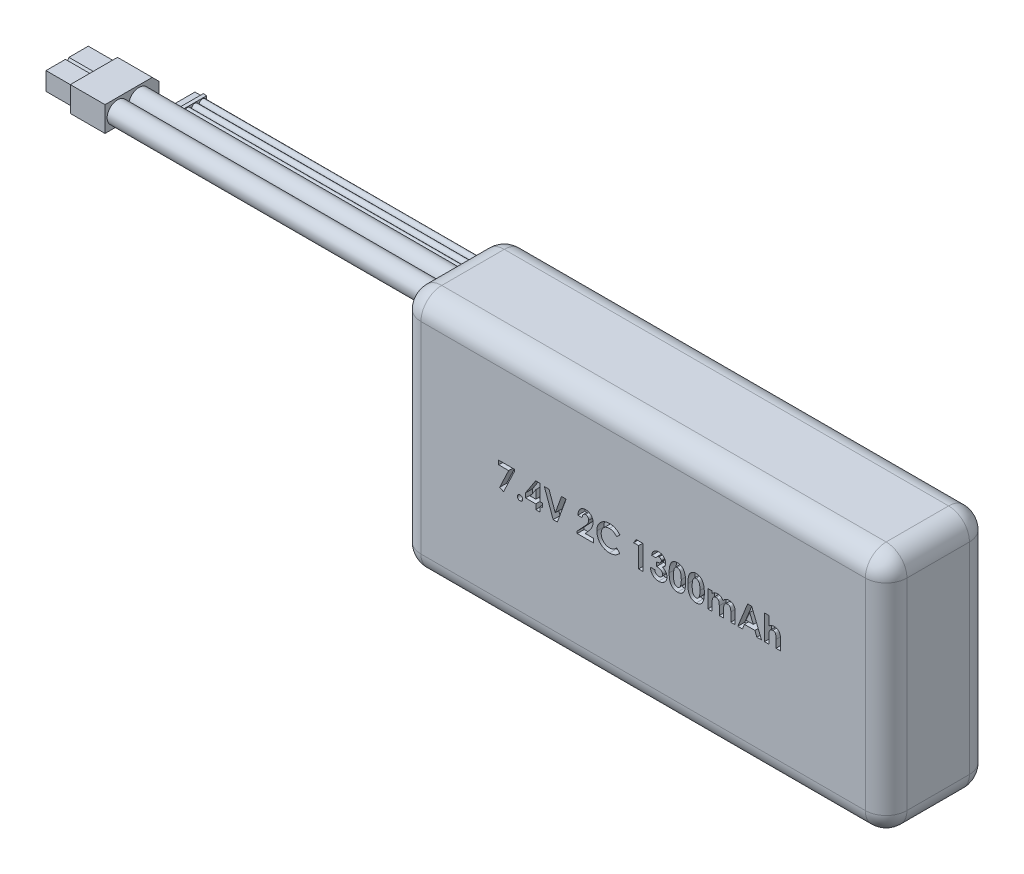
from build123d import *

# Parameters (mm, degrees)
SKETCH_1_W           = 70
SKETCH_1_H           = 35
EXTRUDE_1_DEPTH      = 15
FILLET_2_R           = 3
CUT_EXTRUDE_2_DEPTH  = 1
EXTRUDE_2_DEPTH      = 50
EXTRUDE_2_DEPTH_BACK = 5
SKETCH_3_R           = 1.5
SKETCH_5_W           = 7.8
SKETCH_5_H           = 3.6
EXTRUDE_3_DEPTH      = 5
CHAMFER_1_SIZE       = 1
EXTRUDE_4_DEPTH      = 4
CUT_EXTRUDE_3_DEPTH  = 4
EXTRUDE_5_DEPTH      = 40
EXTRUDE_5_DEPTH_BACK = 4
SKETCH_7_R           = 0.5
SKETCH_8_W           = 3.4
SKETCH_8_H           = 1.2
EXTRUDE_6_DEPTH      = 0.5
EXTRUDE_7_DEPTH      = 1


with BuildPart() as part:
    # ｽｹｯﾁ1 → ﾎﾞｽ - 押し出し1 (new body)
    with BuildSketch(Plane.XY):
        Rectangle(SKETCH_1_W, SKETCH_1_H)
    extrude(amount=EXTRUDE_1_DEPTH)

    # ﾌｨﾚｯﾄ2
    fillet_2_edges = [part.edges().sort_by_distance(p)[0] for p in [
        (35, 0, 15),
        (0, 17.5, 15),
        (-35, 0, 15),
        (0, 17.5, 0),
        (35, 0, 0),
        (0, -17.5, 0),
        (-35, 0, 0),
        (0, -17.5, 15),
        (-35, 17.5, 7.5),
        (35, 17.5, 7.5),
        (35, -17.5, 7.5),
        (-35, -17.5, 7.5),
    ]]
    fillet(fillet_2_edges, radius=FILLET_2_R)

    # ｽｹｯﾁ2 → ｶｯﾄ - 押し出し2 (cut)
    # profile 1 of 13: a face of its own
    with BuildSketch(Plane.XY.offset(15)):
        Polygon((-20.796502723, 2.806037284), (-18.552912979, 2.806037284), (-18.552912979, 2.48001565), (-20.096783171, -0.783706305), (-20.653473877, -0.503257587), (-19.363409774, 2.222703951), (-20.796502723, 2.222703951), align=None)
    # profile 2 of 13: a face of its own
    with BuildSketch(Plane.XY.offset(15)):
        with BuildLine():
            add(Edge.make_bspline(
                [(-17.722784774, 0.023986002), (-17.697424878, 0.02259558), (-17.647495622, 0.019858079), (-17.575354655, -0.000571605), (-17.510247017, -0.037276444), (-17.45203209, -0.085151545), (-17.402807013, -0.142751683), (-17.367228241, -0.208437598), (-17.345072447, -0.280300596), (-17.342626431, -0.330386935), (-17.341374518, -0.35602201)],
                knots=[0, 0, 0, 0, 1.016957001, 2.002212695, 2.9757545, 3.99499976, 5.013036768, 5.994806404, 6.97370641, 8, 8, 8, 8], degree=3))
            add(Edge.make_bspline(
                [(-17.341374518, -0.35602201), (-17.34261823, -0.381661203), (-17.345048222, -0.431755586), (-17.367381557, -0.503758614), (-17.402753847, -0.569984407), (-17.452036039, -0.628201769), (-17.510005929, -0.676979121), (-17.575504349, -0.713345487), (-17.647358195, -0.734934096), (-17.697400689, -0.737521864), (-17.722784774, -0.73883451)],
                knots=[0, 0, 0, 0, 1.023218912, 1.999186227, 2.986238111, 4.008388923, 5.030539734, 6.0011649, 6.986089706, 8, 8, 8, 8], degree=3))
            add(Edge.make_bspline(
                [(-17.722784774, -0.73883451), (-17.748174874, -0.737532538), (-17.798229225, -0.734965813), (-17.870194763, -0.713163516), (-17.936176743, -0.677221916), (-17.994161198, -0.628142602), (-18.043663561, -0.57019056), (-18.078030185, -0.50354966), (-18.100571548, -0.431782732), (-18.10296832, -0.381670393), (-18.10419503, -0.35602201)],
                knots=[0, 0, 0, 0, 1.013427518, 1.99788335, 2.976245624, 3.997909735, 5.019573847, 6.001765691, 6.977268297, 8, 8, 8, 8], degree=3))
            add(Edge.make_bspline(
                [(-18.10419503, -0.35602201), (-18.102960227, -0.330377585), (-18.100547643, -0.280272977), (-18.078183064, -0.208648959), (-18.043608483, -0.14254441), (-17.994165326, -0.085210835), (-17.935934413, -0.037035544), (-17.870345297, -0.000751083), (-17.798091867, 0.01989003), (-17.748150714, 0.022606342), (-17.722784774, 0.023986002)],
                knots=[0, 0, 0, 0, 1.025808215, 2.00424526, 2.981110158, 3.998665696, 5.017428914, 5.998734231, 6.983523959, 8, 8, 8, 8], degree=3))
        make_face()
    # profile 3 of 13: a face of its own
    with BuildSketch(Plane.XY.offset(15)):
        Polygon((-15.483401761, 2.895780874), (-14.828554005, 2.895780874), (-14.828554005, 0.607319336), (-14.514451441, 0.607319336), (-14.514451441, 0.023986002), (-14.828554005, 0.023986002), (-14.828554005, -0.693962716), (-15.456759133, -0.693962716), (-15.456759133, 0.023986002), (-16.937528364, 0.023986002), (-16.937528364, 0.65990347), align=None)
        Polygon((-15.456759133, 0.607319336), (-15.456759133, 1.798525265), (-16.231498716, 0.607319336), align=None, mode=Mode.SUBTRACT)
    # profile 4 of 13: a face of its own
    with BuildSketch(Plane.XY.offset(15)):
        Polygon((-14.222784774, 2.806037284), (-13.551811216, 2.806037284), (-12.652271954, 0.3198594), (-11.750629325, 2.806037284), (-11.081759133, 2.806037284), (-12.350789582, -0.693962716), (-12.955857691, -0.693962716), align=None)
    # profile 5 of 13: a face of its own
    with BuildSketch(Plane.XY.offset(15)):
        with BuildLine():
            Line((-8.770861697, 1.639370618), (-9.399066825, 1.639370618))
            add(Edge.make_bspline(
                [(-9.399066825, 1.639370618), (-9.396353704, 1.686891012), (-9.391052427, 1.77974301), (-9.369965288, 1.91461351), (-9.341709246, 2.042051301), (-9.303997806, 2.161610593), (-9.256610915, 2.273247941), (-9.200767958, 2.377343922), (-9.135042276, 2.473350471), (-9.060832727, 2.560804588), (-8.979399185, 2.639260483), (-8.89243229, 2.708824409), (-8.798601767, 2.76622681), (-8.699621976, 2.813463671), (-8.59550977, 2.851203729), (-8.485280086, 2.876436011), (-8.369887351, 2.89352356), (-8.29089168, 2.895018789), (-8.250629325, 2.895780874)],
                knots=[0, 0, 0, 0, 1.199038563, 2.342849363, 3.436047546, 4.486744587, 5.497670872, 6.488682221, 7.459191391, 8.424610317, 9.374430501, 10.305433194, 11.225809216, 12.140057399, 13.06607119, 14.010487599, 14.985989317, 16, 16, 16, 16], degree=3))
            add(Edge.make_bspline(
                [(-8.250629325, 2.895780874), (-8.201207856, 2.894238794), (-8.104725565, 2.891228292), (-7.964529145, 2.865547713), (-7.833601016, 2.822592975), (-7.712036353, 2.762573878), (-7.600870055, 2.686325907), (-7.500120559, 2.595412681), (-7.412834688, 2.487926791), (-7.338459025, 2.368340552), (-7.276661738, 2.241715555), (-7.233356774, 2.110780056), (-7.204892887, 1.979008555), (-7.201857037, 1.890280295), (-7.200348877, 1.846201547)],
                knots=[0, 0, 0, 0, 1.075374347, 2.099382735, 3.09057751, 4.06680945, 5.040638231, 6.016817125, 7.011024321, 8.044445721, 9.0776792, 10.070479129, 11.0414456, 12, 12, 12, 12], degree=3))
            add(Edge.make_bspline(
                [(-7.200348877, 1.846201547), (-7.200936075, 1.819539605), (-7.202117959, 1.765875702), (-7.21033576, 1.684669045), (-7.222664085, 1.601950571), (-7.241252195, 1.517791203), (-7.264433091, 1.43216735), (-7.292554869, 1.344822768), (-7.326269841, 1.256252671), (-7.365015373, 1.165460216), (-7.41123889, 1.072150636), (-7.465059751, 0.974925183), (-7.527906482, 0.873870106), (-7.599019976, 0.768414813), (-7.678745612, 0.658725624), (-7.767472586, 0.545132958), (-7.864178971, 0.427236549), (-7.932814213, 0.348429416), (-7.968077242, 0.307940329)],
                knots=[0, 0, 0, 0, 0.728284026, 1.46585585, 2.227944881, 3.01186502, 3.81876927, 4.650621989, 5.517437689, 6.406905708, 7.346299482, 8.360816762, 9.441613733, 10.596154504, 11.834900912, 13.145207542, 14.533280747, 16, 16, 16, 16], degree=3))
            Line((-7.968077242, 0.307940329), (-8.333361697, -0.110629382))
            Line((-8.333361697, -0.110629382), (-7.155477082, -0.110629382))
            Line((-7.155477082, -0.110629382), (-7.155477082, -0.693962716))
            Line((-7.155477082, -0.693962716), (-9.488810415, -0.693962716))
            Line((-9.488810415, -0.693962716), (-9.488810415, -0.375653421))
            Line((-9.488810415, -0.375653421), (-8.452552402, 0.727211163))
            add(Edge.make_bspline(
                [(-8.452552402, 0.727211163), (-8.42255007, 0.759382065), (-8.364444449, 0.821687562), (-8.281766139, 0.913189814), (-8.206949572, 1.000023267), (-8.14154613, 1.083112521), (-8.082123525, 1.159762501), (-8.031331406, 1.232283531), (-7.988705065, 1.300019996), (-7.942428126, 1.381698343), (-7.898480246, 1.479114306), (-7.858155406, 1.59134149), (-7.833574626, 1.698604831), (-7.830181701, 1.76849993), (-7.828554005, 1.802030874)],
                knots=[0, 0, 0, 0, 1.246127091, 2.413378631, 3.493388633, 4.492180848, 5.408488754, 6.240484944, 6.999099869, 7.674939598, 8.898438119, 10.020720584, 11.050475521, 12, 12, 12, 12], degree=3))
            add(Edge.make_bspline(
                [(-7.828554005, 1.802030874), (-7.829770994, 1.834469476), (-7.832129105, 1.897324467), (-7.858042839, 1.986735357), (-7.898189293, 2.067687791), (-7.954761317, 2.137762818), (-8.023287756, 2.195348115), (-8.102476494, 2.238178441), (-8.191681909, 2.262891343), (-8.254216604, 2.265984515), (-8.286386537, 2.267575746)],
                knots=[0, 0, 0, 0, 1.062038974, 2.057870785, 3.028805853, 4.01125022, 4.991535629, 5.949134679, 6.94496649, 8, 8, 8, 8], degree=3))
            add(Edge.make_bspline(
                [(-8.286386537, 2.267575746), (-8.303005934, 2.266987926), (-8.335723886, 2.265830708), (-8.383816718, 2.258127423), (-8.429580502, 2.244551188), (-8.473524616, 2.226360943), (-8.515180077, 2.202249642), (-8.554441815, 2.172528623), (-8.591723502, 2.137953164), (-8.626854151, 2.098631377), (-8.658827628, 2.054748251), (-8.687226353, 2.00670457), (-8.710707371, 1.954530154), (-8.731380913, 1.898913787), (-8.747325337, 1.839258102), (-8.758934856, 1.775920132), (-8.767760798, 1.709002921), (-8.769809261, 1.66300363), (-8.770861697, 1.639370618)],
                knots=[0, 0, 0, 0, 0.903469896, 1.778625579, 2.63899355, 3.493148037, 4.358286772, 5.247621495, 6.164656832, 7.118446693, 8.109501108, 9.111810964, 10.146451449, 11.215617525, 12.33435995, 13.498009769, 14.714554818, 16, 16, 16, 16], degree=3))
        make_face()
    # profile 6 of 13: a face of its own
    with BuildSketch(Plane.XY.offset(15)):
        with BuildLine():
            Line((-3.341374518, 2.19886581), (-3.802011537, 1.758561323))
            add(Edge.make_bspline(
                [(-3.802011537, 1.758561323), (-3.841086522, 1.798964923), (-3.917412208, 1.877885811), (-4.040401613, 1.982370112), (-4.168306116, 2.069443639), (-4.298637591, 2.14277641), (-4.433740322, 2.198257877), (-4.572052154, 2.238688157), (-4.714456249, 2.26333697), (-4.810829864, 2.266157231), (-4.859303204, 2.267575746)],
                knots=[0, 0, 0, 0, 1.115251505, 2.178435587, 3.19620269, 4.182487026, 5.141301733, 6.088180966, 7.038406374, 8, 8, 8, 8], degree=3))
            add(Edge.make_bspline(
                [(-4.859303204, 2.267575746), (-4.899784333, 2.266455069), (-4.979669381, 2.264243537), (-5.096961566, 2.248030827), (-5.209157603, 2.220460408), (-5.316641556, 2.182463263), (-5.41909715, 2.133296975), (-5.516739195, 2.072999596), (-5.609326958, 2.002115697), (-5.69563741, 1.921012036), (-5.774591179, 1.832400192), (-5.84435186, 1.737851565), (-5.902787621, 1.637582762), (-5.950744899, 1.532609231), (-5.988101766, 1.422445103), (-6.014779261, 1.307164544), (-6.030208812, 1.186630264), (-6.032511776, 1.104691959), (-6.03368221, 1.063048502)],
                knots=[0, 0, 0, 0, 1.035432265, 2.043311493, 3.022114605, 3.98653278, 4.95457646, 5.923598177, 6.917315552, 7.932509744, 8.948865224, 9.949768934, 10.933144597, 11.912367597, 12.897413939, 13.903909035, 14.934704909, 16, 16, 16, 16], degree=3))
            add(Edge.make_bspline(
                [(-6.03368221, 1.063048502), (-6.033344904, 1.033820211), (-6.032680068, 0.976210647), (-6.025402256, 0.890990113), (-6.013683264, 0.808306048), (-5.996722979, 0.728283696), (-5.975513975, 0.65085371), (-5.950630985, 0.575348104), (-5.919415639, 0.502810196), (-5.884766135, 0.432397506), (-5.84446916, 0.366031331), (-5.801021588, 0.302745676), (-5.75390979, 0.24285076), (-5.702828619, 0.186591435), (-5.647059172, 0.134846909), (-5.588042883, 0.086061162), (-5.524784229, 0.041455467), (-5.458597251, -8.9606e-05), (-5.388910179, -0.036180164), (-5.317613785, -0.068871237), (-5.24362707, -0.095421249), (-5.167850868, -0.11682298), (-5.090555976, -0.135021957), (-5.010986379, -0.146227626), (-4.929831845, -0.154713548), (-4.874985002, -0.155237504), (-4.847384133, -0.155501177)],
                knots=[0, 0, 0, 0, 1.103660481, 2.175337485, 3.227646561, 4.255952547, 5.262355991, 6.258840057, 7.255597736, 8.242457506, 9.22035537, 10.185017736, 11.140346927, 12.096287581, 13.051739095, 14.01125915, 14.986044842, 15.97314143, 16.960198552, 17.947847494, 18.933482797, 19.925264591, 20.920966487, 21.929612487, 22.958107872, 24, 24, 24, 24], degree=3))
            add(Edge.make_bspline(
                [(-4.847384133, -0.155501177), (-4.800568316, -0.154147015), (-4.70858741, -0.151486439), (-4.573592204, -0.130681112), (-4.444955222, -0.096457527), (-4.342174889, -0.056041461), (-4.261649212, -0.016130071), (-4.200346205, 0.020785999), (-4.136954118, 0.062080677), (-4.072525839, 0.109312468), (-4.006336678, 0.161914572), (-3.939555026, 0.221039073), (-3.870471261, 0.284739086), (-3.825215172, 0.330203037), (-3.802011537, 0.353513246)],
                knots=[0, 0, 0, 0, 1.404581149, 2.759636711, 4.088442092, 5.392261763, 6.066678138, 6.783632037, 7.538459478, 8.336747902, 9.180226004, 10.074962426, 11.012997595, 12, 12, 12, 12], degree=3))
            Line((-3.802011537, 0.353513246), (-3.355396954, -0.115537235))
            add(Edge.make_bspline(
                [(-3.355396954, -0.115537235), (-3.386791555, -0.145847737), (-3.448067103, -0.205007354), (-3.540499565, -0.289008491), (-3.632815698, -0.36449285), (-3.722785335, -0.434200184), (-3.811882274, -0.496099747), (-3.900097065, -0.550253361), (-3.986431079, -0.598030647), (-4.072677068, -0.638625867), (-4.159371701, -0.673095424), (-4.24857029, -0.702771451), (-4.340545524, -0.727876302), (-4.435859146, -0.748132619), (-4.533622127, -0.764375451), (-4.634749401, -0.775339269), (-4.738599769, -0.782709879), (-4.809043083, -0.783372189), (-4.844579646, -0.783706305)],
                knots=[0, 0, 0, 0, 1.244526981, 2.429050516, 3.560637417, 4.644440555, 5.67424972, 6.652764056, 7.595344123, 8.486817594, 9.369275933, 10.254498637, 11.166417451, 12.086725134, 13.032340136, 13.991389299, 14.986715468, 16, 16, 16, 16], degree=3))
            add(Edge.make_bspline(
                [(-4.844579646, -0.783706305), (-4.90985591, -0.782042283), (-5.037583414, -0.778786254), (-5.22476474, -0.754661285), (-5.402581976, -0.7142162), (-5.571467717, -0.657015694), (-5.731368261, -0.583944728), (-5.882242701, -0.494363155), (-6.023847862, -0.388508978), (-6.155039851, -0.267622913), (-6.273709249, -0.134114401), (-6.378599254, 0.009237113), (-6.46536427, 0.16313615), (-6.537407132, 0.325309131), (-6.593743703, 0.496496112), (-6.633395099, 0.676882267), (-6.657847825, 0.866293421), (-6.660522988, 0.995665605), (-6.661887338, 1.061646259)],
                knots=[0, 0, 0, 0, 1.078019885, 2.10938526, 3.111377082, 4.085535484, 5.04941344, 6.010039228, 6.978205633, 7.964457913, 8.951525778, 9.924444315, 10.892603023, 11.863865945, 12.85144698, 13.863884204, 14.910567087, 16, 16, 16, 16], degree=3))
            add(Edge.make_bspline(
                [(-6.661887338, 1.061646259), (-6.66131083, 1.104678278), (-6.660168331, 1.189957223), (-6.648160564, 1.315580017), (-6.631421038, 1.438039771), (-6.604865302, 1.556064947), (-6.572854982, 1.671245561), (-6.533045943, 1.782329735), (-6.485501766, 1.889636736), (-6.431754911, 1.993346202), (-6.370951632, 2.092778724), (-6.303027695, 2.187080022), (-6.229731726, 2.276978083), (-6.149302543, 2.361280243), (-6.062908887, 2.440726692), (-5.970160701, 2.514886893), (-5.871615818, 2.584824387), (-5.767007515, 2.648735658), (-5.658368052, 2.706546799), (-5.547067658, 2.757538694), (-5.433379786, 2.800156176), (-5.317785118, 2.835505805), (-5.199795268, 2.861891804), (-5.080252418, 2.881865154), (-4.958139402, 2.893030384), (-4.87615109, 2.894858203), (-4.834763941, 2.895780874)],
                knots=[0, 0, 0, 0, 1.071919942, 2.124283339, 3.142214191, 4.149696895, 5.136002878, 6.119640489, 7.086990633, 8.058538607, 9.028339693, 9.988281803, 10.952401235, 11.916291999, 12.888973767, 13.874849856, 14.873389453, 15.898127285, 16.927174885, 17.938320013, 18.946391617, 19.950418109, 20.947802303, 21.956882652, 22.968648068, 24, 24, 24, 24], degree=3))
            add(Edge.make_bspline(
                [(-4.834763941, 2.895780874), (-4.799456458, 2.895251976), (-4.729208594, 2.894199679), (-4.624597735, 2.885427639), (-4.520823504, 2.871651238), (-4.418257446, 2.850865583), (-4.316165903, 2.826190383), (-4.215890472, 2.793881614), (-4.115849255, 2.757867401), (-4.017611248, 2.714819764), (-3.921039326, 2.667829379), (-3.828395839, 2.614517081), (-3.738125311, 2.558163649), (-3.652228083, 2.495433841), (-3.569095114, 2.428602982), (-3.489161115, 2.357359269), (-3.413127552, 2.280514861), (-3.365413109, 2.22621975), (-3.341374518, 2.19886581)],
                knots=[0, 0, 0, 0, 0.996412454, 1.982464992, 2.961075852, 3.949442424, 4.934965278, 5.923860011, 6.921385422, 7.934793307, 8.949617135, 9.951082467, 10.950285876, 11.951772932, 12.951063433, 13.960125323, 14.972308753, 16, 16, 16, 16], degree=3))
        make_face()
    # profile 7 of 13: a face of its own
    with BuildSketch(Plane.XY.offset(15)):
        Polygon((-0.991915383, 2.806037284), (-0.020861697, 2.806037284), (-0.020861697, -0.693962716), (-0.649066825, -0.693962716), (-0.649066825, 2.222703951), (-1.367015543, 2.222703951), align=None)
    # profile 8 of 13: a face of its own
    with BuildSketch(Plane.XY.offset(15)):
        with BuildLine():
            Line((1.863753688, 1.953473182), (1.235548559, 1.953473182))
            add(Edge.make_bspline(
                [(1.235548559, 1.953473182), (1.239983926, 1.984874915), (1.24867917, 2.046435933), (1.269485725, 2.135560951), (1.294372609, 2.220102131), (1.325442613, 2.299791747), (1.361882673, 2.374771752), (1.403322234, 2.445299443), (1.450209274, 2.5110721), (1.486148687, 2.55069381), (1.504078207, 2.570460361)],
                knots=[0, 0, 0, 0, 1.111473889, 2.178970933, 3.205615836, 4.199322666, 5.174200091, 6.12565194, 7.064921805, 8, 8, 8, 8], degree=3))
            add(Edge.make_bspline(
                [(1.504078207, 2.570460361), (1.529939164, 2.596540893), (1.580908392, 2.647942881), (1.66608395, 2.713783149), (1.755363665, 2.770763424), (1.85053808, 2.815937798), (1.950126211, 2.85250122), (2.054920015, 2.877060954), (2.164491269, 2.893356554), (2.239259865, 2.894961727), (2.277415546, 2.895780874)],
                knots=[0, 0, 0, 0, 1.01925491, 2.00884431, 2.983262333, 3.955970413, 4.92937149, 5.924503185, 6.940838805, 8, 8, 8, 8], degree=3))
            add(Edge.make_bspline(
                [(2.277415546, 2.895780874), (2.311337911, 2.894980034), (2.378022443, 2.893405742), (2.476031927, 2.880768188), (2.569475767, 2.858603323), (2.659341694, 2.829623261), (2.744308071, 2.790191042), (2.826250188, 2.74441863), (2.902878581, 2.688276864), (2.974372546, 2.624842318), (3.040053388, 2.556231646), (3.096933284, 2.482892481), (3.145833952, 2.40678388), (3.186121635, 2.327273525), (3.217097387, 2.244226875), (3.238595479, 2.158123678), (3.252666501, 2.069153929), (3.254068343, 2.008682388), (3.254779329, 1.978012445)],
                knots=[0, 0, 0, 0, 1.091422571, 2.145516843, 3.172569842, 4.178562979, 5.178154469, 6.181868002, 7.194278174, 8.227918432, 9.254613415, 10.245994977, 11.209837596, 12.161663635, 13.10878368, 14.055455738, 15.013766427, 16, 16, 16, 16], degree=3))
            add(Edge.make_bspline(
                [(3.254779329, 1.978012445), (3.253320343, 1.940030273), (3.25044805, 1.865255055), (3.226878805, 1.755815968), (3.189986527, 1.65117267), (3.136692043, 1.552789279), (3.070060364, 1.460933539), (2.988305525, 1.378676464), (2.893756117, 1.304728373), (2.822776617, 1.26498866), (2.78642997, 1.244639047)],
                knots=[0, 0, 0, 0, 0.992805628, 1.954529043, 2.915727527, 3.886831945, 4.871318353, 5.87440735, 6.911542536, 8, 8, 8, 8], degree=3))
            add(Edge.make_bspline(
                [(2.78642997, 1.244639047), (2.811377751, 1.236448165), (2.860399022, 1.22035345), (2.930076865, 1.18865509), (2.996332531, 1.154014037), (3.058025123, 1.113770264), (3.115768247, 1.069551053), (3.169209894, 1.0209784), (3.218669366, 0.968158218), (3.263339258, 0.910800015), (3.302985532, 0.849821123), (3.338558022, 0.78663012), (3.367836165, 0.720268702), (3.392638397, 0.651494761), (3.411521404, 0.579690194), (3.424816729, 0.505133237), (3.432501752, 0.427993959), (3.43367385, 0.375732146), (3.434266508, 0.349306515)],
                knots=[0, 0, 0, 0, 1.059543567, 2.081955587, 3.086750234, 4.076226789, 5.052108497, 6.020845489, 6.989030705, 7.970690546, 8.952259656, 9.923888338, 10.895517021, 11.877585046, 12.873342345, 13.889638361, 14.932918083, 16, 16, 16, 16], degree=3))
            add(Edge.make_bspline(
                [(3.434266508, 0.349306515), (3.43306511, 0.310471568), (3.430696197, 0.233896961), (3.415635757, 0.121110401), (3.387595932, 0.013578436), (3.350707989, -0.08993625), (3.301503476, -0.188097321), (3.243598036, -0.28315744), (3.172420617, -0.371819948), (3.093319137, -0.456428851), (3.005472332, -0.533351478), (2.910232104, -0.600039934), (2.809692704, -0.657270494), (2.703218047, -0.703731894), (2.590845127, -0.739512485), (2.472824411, -0.765376346), (2.348660009, -0.781200284), (2.26390809, -0.782859124), (2.220624681, -0.783706305)],
                knots=[0, 0, 0, 0, 1.005138573, 1.981928558, 2.936866704, 3.876260664, 4.820238198, 5.773547, 6.751179199, 7.756627054, 8.768222608, 9.766606018, 10.760583154, 11.757261445, 12.767156078, 13.807575856, 14.880313354, 16, 16, 16, 16], degree=3))
            add(Edge.make_bspline(
                [(2.220624681, -0.783706305), (2.179679274, -0.782813096), (2.099615949, -0.781066543), (1.982506579, -0.765949242), (1.871205208, -0.741563808), (1.765427793, -0.707190517), (1.665583578, -0.662614233), (1.570767138, -0.609533881), (1.482870513, -0.544887909), (1.400914362, -0.471594559), (1.32671672, -0.389363582), (1.260401501, -0.300099817), (1.203430968, -0.203463831), (1.155571482, -0.099868494), (1.117197199, 0.010867933), (1.086927677, 0.12852026), (1.06578392, 0.253318345), (1.059344544, 0.339182082), (1.05606138, 0.382960361)],
                knots=[0, 0, 0, 0, 1.066544725, 2.085487077, 3.070979577, 4.031932826, 4.977951092, 5.916076795, 6.857635327, 7.814973522, 8.776389752, 9.738577119, 10.707772778, 11.69409279, 12.707140348, 13.757286496, 14.856535458, 16, 16, 16, 16], degree=3))
            Line((1.05606138, 0.382960361), (1.684266508, 0.382960361))
            add(Edge.make_bspline(
                [(1.684266508, 0.382960361), (1.688247378, 0.360948068), (1.696001167, 0.318073353), (1.711124457, 0.256000298), (1.730832214, 0.198703034), (1.753619284, 0.145672304), (1.778232751, 0.096211835), (1.807971704, 0.052148323), (1.84065703, 0.012285263), (1.887822194, -0.035104382), (1.955248044, -0.083795264), (2.046295279, -0.126109956), (2.147576706, -0.150911565), (2.218382525, -0.153937285), (2.254979649, -0.155501177)],
                knots=[0, 0, 0, 0, 0.928156231, 1.807827665, 2.648129825, 3.438902246, 4.202261636, 4.936546065, 5.639352463, 6.338805438, 7.70633318, 9.064371875, 10.482673459, 12, 12, 12, 12], degree=3))
            add(Edge.make_bspline(
                [(2.254979649, -0.155501177), (2.274399377, -0.155168161), (2.312438279, -0.154515857), (2.368311762, -0.147285941), (2.421539122, -0.135378263), (2.472219498, -0.119196171), (2.520675522, -0.098910906), (2.565981396, -0.072754271), (2.609060566, -0.042343449), (2.649444721, -0.008153612), (2.686760513, 0.029101072), (2.717809447, 0.070354305), (2.746185925, 0.112274962), (2.767173373, 0.157605642), (2.785562899, 0.203907069), (2.796818228, 0.252859841), (2.80531681, 0.303437058), (2.805810714, 0.338049886), (2.80606138, 0.355616611)],
                knots=[0, 0, 0, 0, 1.110435564, 2.175094844, 3.216326037, 4.226890168, 5.215276772, 6.21526065, 7.213097102, 8.228249917, 9.239874822, 10.221364777, 11.178138315, 12.128914389, 13.072518965, 14.022636769, 14.996447288, 16, 16, 16, 16], degree=3))
            add(Edge.make_bspline(
                [(2.80606138, 0.355616611), (2.805395908, 0.374828819), (2.804071106, 0.413075921), (2.793247334, 0.468889524), (2.776154311, 0.522577712), (2.752410015, 0.573902729), (2.720702153, 0.6226754), (2.683287229, 0.669874252), (2.637217567, 0.713042671), (2.586672978, 0.755713344), (2.528061111, 0.792909302), (2.464236446, 0.827235705), (2.393521572, 0.854548925), (2.317642703, 0.878944689), (2.235164518, 0.896762977), (2.146599177, 0.90970079), (2.052089548, 0.919330987), (1.986942833, 0.920712597), (1.953497277, 0.9214219)],
                knots=[0, 0, 0, 0, 0.809814727, 1.612155564, 2.388397, 3.182215007, 3.988903953, 4.837162975, 5.715530372, 6.646997145, 7.623086902, 8.637258368, 9.698941581, 10.815059213, 11.996518529, 13.252603015, 14.589518788, 16, 16, 16, 16], degree=3))
            Line((1.953497277, 0.9214219), (1.953497277, 1.504755233))
            add(Edge.make_bspline(
                [(1.953497277, 1.504755233), (1.995138983, 1.508301574), (2.073042367, 1.514936076), (2.181176442, 1.530451088), (2.272211394, 1.551189456), (2.34833525, 1.576209175), (2.411543622, 1.608341013), (2.466762107, 1.643813143), (2.514318878, 1.685008838), (2.554510729, 1.730699647), (2.58666296, 1.779767292), (2.609418435, 1.831449116), (2.624444962, 1.884146019), (2.625868725, 1.920189112), (2.6265742, 1.938048502)],
                knots=[0, 0, 0, 0, 1.70044513, 3.18119609, 4.440695891, 5.496282586, 6.431922213, 7.318171381, 8.16090191, 8.983045123, 9.787564368, 10.536848927, 11.275007137, 12, 12, 12, 12], degree=3))
            add(Edge.make_bspline(
                [(2.6265742, 1.938048502), (2.625357053, 1.960835145), (2.622981439, 2.005309846), (2.604531131, 2.068962514), (2.572503489, 2.125703591), (2.529560043, 2.175413678), (2.477231962, 2.216935269), (2.415894278, 2.247079236), (2.346878022, 2.264790163), (2.298321367, 2.266626189), (2.273208816, 2.267575746)],
                knots=[0, 0, 0, 0, 1.009664648, 1.970651636, 2.907870547, 3.878035693, 4.867062054, 5.849714035, 6.887914197, 8, 8, 8, 8], degree=3))
            add(Edge.make_bspline(
                [(2.273208816, 2.267575746), (2.250447111, 2.266455369), (2.205280919, 2.264232197), (2.139234426, 2.247639033), (2.076512263, 2.219706507), (2.018413227, 2.181189199), (1.965775991, 2.134931544), (1.922576006, 2.080148955), (1.886644308, 2.020123549), (1.871413807, 1.975777067), (1.863753688, 1.953473182)],
                knots=[0, 0, 0, 0, 0.98818071, 1.960853194, 2.938124878, 3.957524365, 4.978590984, 5.968022688, 6.978025184, 8, 8, 8, 8], degree=3))
        make_face()
    # profile 9 of 13: a face of its own
    with BuildSketch(Plane.XY.offset(15)):
        with BuildLine():
            add(Edge.make_bspline(
                [(4.926954809, 2.895780874), (4.957362545, 2.895329463), (5.017152277, 2.894441867), (5.105211299, 2.884828486), (5.190036483, 2.870305348), (5.271959677, 2.850050634), (5.35039119, 2.823244242), (5.425901861, 2.79115745), (5.497592895, 2.75210724), (5.566378583, 2.707998022), (5.632232428, 2.658060135), (5.693571679, 2.601128365), (5.75151652, 2.538512715), (5.80481266, 2.469266548), (5.854640357, 2.394019731), (5.900835887, 2.312760334), (5.943045611, 2.225090645), (5.981742599, 2.130852458), (6.016345567, 2.028633183), (6.045491605, 1.917260321), (6.07048921, 1.796708437), (6.091588952, 1.66667746), (6.107536946, 1.526994548), (6.118286216, 1.377752499), (6.125662873, 1.219239029), (6.126264904, 1.110500091), (6.1265742, 1.054635041)],
                knots=[0, 0, 0, 0, 0.879237366, 1.728815576, 2.559023295, 3.367336655, 4.166867292, 4.954216142, 5.737608147, 6.525189134, 7.316157332, 8.124696809, 8.942788509, 9.781158001, 10.649253743, 11.551476218, 12.482711956, 13.461909668, 14.496590415, 15.601789533, 16.789733467, 18.056700938, 19.410929216, 20.8549011, 22.384193279, 24, 24, 24, 24], degree=3))
            add(Edge.make_bspline(
                [(6.1265742, 1.054635041), (6.126239935, 0.998071056), (6.125590463, 0.888168249), (6.118592865, 0.728204935), (6.106542671, 0.577879298), (6.09101151, 0.437206892), (6.069738069, 0.306262004), (6.044823912, 0.184705573), (6.015217813, 0.072581662), (5.979475033, -0.029857091), (5.941012279, -0.124260781), (5.898687094, -0.211759534), (5.853237199, -0.292590347), (5.805705079, -0.367972661), (5.753484848, -0.435684244), (5.699118211, -0.498027645), (5.640237948, -0.552628122), (5.579323147, -0.60229954), (5.51414225, -0.645225614), (5.445367453, -0.68276805), (5.371772619, -0.713219425), (5.294699257, -0.739704404), (5.212833636, -0.758717761), (5.127476589, -0.773804235), (5.037664454, -0.782141946), (4.976516735, -0.783176294), (4.945183976, -0.783706305)],
                knots=[0, 0, 0, 0, 1.643780988, 3.193836972, 4.651895693, 6.025988579, 7.305620092, 8.505800249, 9.631074763, 10.672816429, 11.65661981, 12.592235626, 13.49536222, 14.350718032, 15.179365177, 15.97804903, 16.751647189, 17.51006938, 18.259804725, 19.016521909, 19.783502495, 20.571750527, 21.382245291, 22.22305063, 23.089471752, 24, 24, 24, 24], degree=3))
            add(Edge.make_bspline(
                [(4.945183976, -0.783706305), (4.913852063, -0.783166071), (4.852473306, -0.782107759), (4.76241831, -0.77386623), (4.676608914, -0.758656645), (4.594095605, -0.739558433), (4.515452661, -0.713278025), (4.440302993, -0.681915567), (4.369224436, -0.644607377), (4.302020185, -0.60158129), (4.238919694, -0.552242211), (4.178942383, -0.497117878), (4.122220924, -0.436348015), (4.069618191, -0.36925195), (4.020272705, -0.296725277), (3.974699059, -0.217939775), (3.932924644, -0.133010154), (3.893642747, -0.041818032), (3.859511751, 0.057599855), (3.829136749, 0.166131294), (3.804254346, 0.284680984), (3.784242253, 0.413210842), (3.768264609, 0.551448569), (3.756379079, 0.699460891), (3.749342612, 0.857316746), (3.748699952, 0.965818939), (3.748369072, 1.021682316)],
                knots=[0, 0, 0, 0, 0.917216111, 1.796812873, 2.643793957, 3.46689424, 4.273913431, 5.068098542, 5.848489301, 6.620921603, 7.401012384, 8.190319798, 9.003608147, 9.831726257, 10.68377682, 11.569763213, 12.493818149, 13.453288342, 14.474581811, 15.568529029, 16.750744269, 18.018426408, 19.375425659, 20.823733699, 22.36466933, 24, 24, 24, 24], degree=3))
            add(Edge.make_bspline(
                [(3.748369072, 1.021682316), (3.74896843, 1.099300082), (3.750124899, 1.24906456), (3.764780519, 1.465430686), (3.786291253, 1.665423691), (3.817885425, 1.848709033), (3.856951182, 2.015965549), (3.906976918, 2.166091441), (3.963927579, 2.301164036), (4.012456859, 2.381181855), (4.035829008, 2.419719175)],
                knots=[0, 0, 0, 0, 1.288568992, 2.486310467, 3.599230591, 4.627010532, 5.572937695, 6.447898582, 7.252493626, 8, 8, 8, 8], degree=3))
            add(Edge.make_bspline(
                [(4.035829008, 2.419719175), (4.06300503, 2.457578227), (4.116139508, 2.531600133), (4.209046628, 2.628777058), (4.308863232, 2.711887524), (4.417639496, 2.779050665), (4.533655078, 2.832015523), (4.657906032, 2.869424006), (4.789933518, 2.891219931), (4.880598996, 2.894237857), (4.926954809, 2.895780874)],
                knots=[0, 0, 0, 0, 1.058512271, 2.069600068, 3.047294572, 4.004278952, 4.967380941, 5.939006123, 6.946246673, 8, 8, 8, 8], degree=3))
        make_face()
        with BuildLine():
            add(Edge.make_bspline(
                [(4.942379489, 2.267575746), (4.914890644, 2.266272829), (4.860997915, 2.263718421), (4.782796999, 2.2420351), (4.709058417, 2.20854404), (4.652967447, 2.168242787), (4.610983914, 2.129609203), (4.581649719, 2.094647065), (4.553361511, 2.05563184), (4.528375941, 2.010802969), (4.50478304, 1.961771208), (4.481725665, 1.908313982), (4.462824672, 1.849118266), (4.444254948, 1.78519217), (4.427986136, 1.714768307), (4.414356439, 1.63727104), (4.402179503, 1.552196398), (4.393685944, 1.459488657), (4.385767399, 1.35924481), (4.38009101, 1.251241555), (4.377717855, 1.135508028), (4.376963501, 1.055804065), (4.3765742, 1.014671099)],
                knots=[0, 0, 0, 0, 1.076674018, 2.110852608, 3.161083442, 4.239746716, 4.804137807, 5.395870207, 6.026861976, 6.692161227, 7.405688833, 8.16177676, 8.973626916, 9.841385931, 10.773283133, 11.807421078, 12.927755683, 14.143907515, 15.458935494, 16.872852025, 18.386167141, 20, 20, 20, 20], degree=3))
            add(Edge.make_bspline(
                [(4.3765742, 1.014671099), (4.377214942, 0.961381352), (4.378443612, 0.859194311), (4.384878811, 0.712245788), (4.397777634, 0.578510799), (4.413821165, 0.457082974), (4.436354959, 0.348749803), (4.462281548, 0.252486355), (4.494298581, 0.169519754), (4.531300431, 0.098650118), (4.572281647, 0.038361466), (4.616768559, -0.01288416), (4.663246549, -0.057260455), (4.713166344, -0.093306772), (4.766408852, -0.120931008), (4.822529595, -0.140800779), (4.881564237, -0.152963894), (4.921990552, -0.154650527), (4.942379489, -0.155501177)],
                knots=[0, 0, 0, 0, 1.771748488, 3.397459088, 4.888034009, 6.237357457, 7.467047327, 8.564189669, 9.548206622, 10.417051504, 11.216568818, 11.965764335, 12.669334354, 13.348544111, 14.005342236, 14.656555988, 15.322436492, 16, 16, 16, 16], degree=3))
            add(Edge.make_bspline(
                [(4.942379489, -0.155501177), (4.962068742, -0.154919099), (5.000617852, -0.153779462), (5.056831088, -0.142081247), (5.109990317, -0.123062489), (5.159935037, -0.09615912), (5.206843892, -0.061947371), (5.250487621, -0.0202769), (5.290537072, 0.02926765), (5.313870063, 0.066037034), (5.325893111, 0.084983599)],
                knots=[0, 0, 0, 0, 0.992283464, 1.942767638, 2.88273346, 3.832339453, 4.79467288, 5.803907806, 6.868395428, 8, 8, 8, 8], degree=3))
            add(Edge.make_bspline(
                [(5.325893111, 0.084983599), (5.340048224, 0.110873474), (5.369730348, 0.165162442), (5.404078553, 0.256773052), (5.432990958, 0.360094679), (5.457875443, 0.475448869), (5.474894912, 0.603290595), (5.489552058, 0.742809199), (5.496621564, 0.894707242), (5.497771457, 0.999942755), (5.498369072, 1.054635041)],
                knots=[0, 0, 0, 0, 0.710965849, 1.490837728, 2.352621235, 3.297892224, 4.334225155, 5.461620853, 6.680770821, 8, 8, 8, 8], degree=3))
            add(Edge.make_bspline(
                [(5.498369072, 1.054635041), (5.498138226, 1.109802082), (5.497693888, 1.21598922), (5.489541561, 1.368433347), (5.478188823, 1.507665757), (5.461583044, 1.6333756), (5.440216692, 1.745868046), (5.413882582, 1.845135739), (5.382836625, 1.931374317), (5.34601982, 2.004497789), (5.305242921, 2.06664271), (5.261956998, 2.119958231), (5.215979021, 2.165477679), (5.167385879, 2.203372349), (5.115052867, 2.232326719), (5.059979615, 2.2527709), (5.002053217, 2.265138944), (4.962539213, 2.266752515), (4.942379489, 2.267575746)],
                knots=[0, 0, 0, 0, 1.793836731, 3.452829483, 4.963243077, 6.335886805, 7.574563692, 8.684454726, 9.672768357, 10.54971625, 11.340229787, 12.085688095, 12.778991901, 13.440269426, 14.083255152, 14.715733572, 15.344777694, 16, 16, 16, 16], degree=3))
        make_face(mode=Mode.SUBTRACT)
    # profile 10 of 13: a face of its own
    with BuildSketch(Plane.XY.offset(15)):
        with BuildLine():
            add(Edge.make_bspline(
                [(7.619262502, 2.895780874), (7.649670237, 2.895329463), (7.70945997, 2.894441867), (7.797518991, 2.884828486), (7.882344176, 2.870305348), (7.96426737, 2.850050634), (8.042698882, 2.823244242), (8.118209553, 2.79115745), (8.189900588, 2.75210724), (8.258686276, 2.707998022), (8.32454012, 2.658060135), (8.385879371, 2.601128365), (8.443824212, 2.538512715), (8.497120352, 2.469266548), (8.546948049, 2.394019731), (8.593143579, 2.312760334), (8.635353303, 2.225090645), (8.674050291, 2.130852458), (8.70865326, 2.028633183), (8.737799297, 1.917260321), (8.762796902, 1.796708437), (8.783896644, 1.66667746), (8.799844638, 1.526994548), (8.810593908, 1.377752499), (8.817970565, 1.219239029), (8.818572597, 1.110500091), (8.818881893, 1.054635041)],
                knots=[0, 0, 0, 0, 0.879237366, 1.728815576, 2.559023295, 3.367336655, 4.166867292, 4.954216142, 5.737608147, 6.525189134, 7.316157332, 8.124696809, 8.942788509, 9.781158001, 10.649253743, 11.551476218, 12.482711956, 13.461909668, 14.496590415, 15.601789533, 16.789733467, 18.056700938, 19.410929216, 20.8549011, 22.384193279, 24, 24, 24, 24], degree=3))
            add(Edge.make_bspline(
                [(8.818881893, 1.054635041), (8.818547627, 0.998071056), (8.817898156, 0.888168249), (8.810900558, 0.728204935), (8.798850363, 0.577879298), (8.783319203, 0.437206892), (8.762045761, 0.306262004), (8.737131604, 0.184705573), (8.707525505, 0.072581662), (8.671782726, -0.029857091), (8.633319971, -0.124260781), (8.590994786, -0.211759534), (8.545544892, -0.292590347), (8.498012771, -0.367972661), (8.44579254, -0.435684244), (8.391425903, -0.498027645), (8.332545641, -0.552628122), (8.271630839, -0.60229954), (8.206449943, -0.645225614), (8.137675145, -0.68276805), (8.064080311, -0.713219425), (7.987006949, -0.739704404), (7.905141328, -0.758717761), (7.819784282, -0.773804235), (7.729972146, -0.782141946), (7.668824427, -0.783176294), (7.637491668, -0.783706305)],
                knots=[0, 0, 0, 0, 1.643780988, 3.193836972, 4.651895693, 6.025988579, 7.305620092, 8.505800249, 9.631074763, 10.672816429, 11.65661981, 12.592235626, 13.49536222, 14.350718032, 15.179365177, 15.97804903, 16.751647189, 17.51006938, 18.259804725, 19.016521909, 19.783502495, 20.571750527, 21.382245291, 22.22305063, 23.089471752, 24, 24, 24, 24], degree=3))
            add(Edge.make_bspline(
                [(7.637491668, -0.783706305), (7.606159755, -0.783166071), (7.544780999, -0.782107759), (7.454726002, -0.77386623), (7.368916606, -0.758656645), (7.286403297, -0.739558433), (7.207760353, -0.713278025), (7.132610685, -0.681915567), (7.061532128, -0.644607377), (6.994327877, -0.60158129), (6.931227387, -0.552242211), (6.871250075, -0.497117878), (6.814528616, -0.436348015), (6.761925884, -0.36925195), (6.712580397, -0.296725277), (6.667006752, -0.217939775), (6.625232336, -0.133010154), (6.585950439, -0.041818032), (6.551819443, 0.057599855), (6.521444441, 0.166131294), (6.496562038, 0.284680984), (6.476549945, 0.413210842), (6.460572302, 0.551448569), (6.448686771, 0.699460891), (6.441650305, 0.857316746), (6.441007644, 0.965818939), (6.440676764, 1.021682316)],
                knots=[0, 0, 0, 0, 0.917216111, 1.796812873, 2.643793957, 3.46689424, 4.273913431, 5.068098542, 5.848489301, 6.620921603, 7.401012384, 8.190319798, 9.003608147, 9.831726257, 10.68377682, 11.569763213, 12.493818149, 13.453288342, 14.474581811, 15.568529029, 16.750744269, 18.018426408, 19.375425659, 20.823733699, 22.36466933, 24, 24, 24, 24], degree=3))
            add(Edge.make_bspline(
                [(6.440676764, 1.021682316), (6.441276122, 1.099300082), (6.442432591, 1.24906456), (6.457088211, 1.465430686), (6.478598945, 1.665423691), (6.510193117, 1.848709033), (6.549258874, 2.015965549), (6.59928461, 2.166091441), (6.656235271, 2.301164036), (6.704764551, 2.381181855), (6.7281367, 2.419719175)],
                knots=[0, 0, 0, 0, 1.288568992, 2.486310467, 3.599230591, 4.627010532, 5.572937695, 6.447898582, 7.252493626, 8, 8, 8, 8], degree=3))
            add(Edge.make_bspline(
                [(6.7281367, 2.419719175), (6.755312722, 2.457578227), (6.8084472, 2.531600133), (6.90135432, 2.628777058), (7.001170924, 2.711887524), (7.109947188, 2.779050665), (7.22596277, 2.832015523), (7.350213724, 2.869424006), (7.48224121, 2.891219931), (7.572906688, 2.894237857), (7.619262502, 2.895780874)],
                knots=[0, 0, 0, 0, 1.058512271, 2.069600068, 3.047294572, 4.004278952, 4.967380941, 5.939006123, 6.946246673, 8, 8, 8, 8], degree=3))
        make_face()
        with BuildLine():
            add(Edge.make_bspline(
                [(7.634687181, 2.267575746), (7.607198336, 2.266272829), (7.553305608, 2.263718421), (7.475104691, 2.2420351), (7.401366109, 2.20854404), (7.34527514, 2.168242787), (7.303291607, 2.129609203), (7.273957411, 2.094647065), (7.245669203, 2.05563184), (7.220683633, 2.010802969), (7.197090733, 1.961771208), (7.174033358, 1.908313982), (7.155132365, 1.849118266), (7.13656264, 1.78519217), (7.120293829, 1.714768307), (7.106664131, 1.63727104), (7.094487195, 1.552196398), (7.085993636, 1.459488657), (7.078075091, 1.35924481), (7.072398703, 1.251241555), (7.070025547, 1.135508028), (7.069271193, 1.055804065), (7.068881893, 1.014671099)],
                knots=[0, 0, 0, 0, 1.076674018, 2.110852608, 3.161083442, 4.239746716, 4.804137807, 5.395870207, 6.026861976, 6.692161227, 7.405688833, 8.16177676, 8.973626916, 9.841385931, 10.773283133, 11.807421078, 12.927755683, 14.143907515, 15.458935494, 16.872852025, 18.386167141, 20, 20, 20, 20], degree=3))
            add(Edge.make_bspline(
                [(7.068881893, 1.014671099), (7.069522634, 0.961381352), (7.070751304, 0.859194311), (7.077186504, 0.712245788), (7.090085326, 0.578510799), (7.106128857, 0.457082974), (7.128662652, 0.348749803), (7.154589241, 0.252486355), (7.186606273, 0.169519754), (7.223608123, 0.098650118), (7.264589339, 0.038361466), (7.309076252, -0.01288416), (7.355554241, -0.057260455), (7.405474037, -0.093306772), (7.458716545, -0.120931008), (7.514837288, -0.140800779), (7.57387193, -0.152963894), (7.614298244, -0.154650527), (7.634687181, -0.155501177)],
                knots=[0, 0, 0, 0, 1.771748488, 3.397459088, 4.888034009, 6.237357457, 7.467047327, 8.564189669, 9.548206622, 10.417051504, 11.216568818, 11.965764335, 12.669334354, 13.348544111, 14.005342236, 14.656555988, 15.322436492, 16, 16, 16, 16], degree=3))
            add(Edge.make_bspline(
                [(7.634687181, -0.155501177), (7.654376434, -0.154919099), (7.692925544, -0.153779462), (7.74913878, -0.142081247), (7.80229801, -0.123062489), (7.85224273, -0.09615912), (7.899151585, -0.061947371), (7.942795314, -0.0202769), (7.982844764, 0.02926765), (8.006177756, 0.066037034), (8.018200803, 0.084983599)],
                knots=[0, 0, 0, 0, 0.992283464, 1.942767638, 2.88273346, 3.832339453, 4.79467288, 5.803907806, 6.868395428, 8, 8, 8, 8], degree=3))
            add(Edge.make_bspline(
                [(8.018200803, 0.084983599), (8.032355916, 0.110873474), (8.06203804, 0.165162442), (8.096386246, 0.256773052), (8.125298651, 0.360094679), (8.150183135, 0.475448869), (8.167202604, 0.603290595), (8.18185975, 0.742809199), (8.188929256, 0.894707242), (8.19007915, 0.999942755), (8.190676764, 1.054635041)],
                knots=[0, 0, 0, 0, 0.710965849, 1.490837728, 2.352621235, 3.297892224, 4.334225155, 5.461620853, 6.680770821, 8, 8, 8, 8], degree=3))
            add(Edge.make_bspline(
                [(8.190676764, 1.054635041), (8.190445919, 1.109802082), (8.19000158, 1.21598922), (8.181849253, 1.368433347), (8.170496515, 1.507665757), (8.153890736, 1.6333756), (8.132524384, 1.745868046), (8.106190274, 1.845135739), (8.075144317, 1.931374317), (8.038327512, 2.004497789), (7.997550614, 2.06664271), (7.954264691, 2.119958231), (7.908286713, 2.165477679), (7.859693571, 2.203372349), (7.80736056, 2.232326719), (7.752287307, 2.2527709), (7.694360909, 2.265138944), (7.654846905, 2.266752515), (7.634687181, 2.267575746)],
                knots=[0, 0, 0, 0, 1.793836731, 3.452829483, 4.963243077, 6.335886805, 7.574563692, 8.684454726, 9.672768357, 10.54971625, 11.340229787, 12.085688095, 12.778991901, 13.440269426, 14.083255152, 14.715733572, 15.344777694, 16, 16, 16, 16], degree=3))
        make_face(mode=Mode.SUBTRACT)
    # profile 11 of 13: a face of its own
    with BuildSketch(Plane.XY.offset(15)):
        with BuildLine():
            Line((9.312471636, 1.863729592), (9.940676764, 1.863729592))
            Line((9.940676764, 1.863729592), (9.940676764, 1.55804049))
            add(Edge.make_bspline(
                [(9.940676764, 1.55804049), (9.968619009, 1.586242245), (10.023634993, 1.641769182), (10.11480724, 1.713154052), (10.209909126, 1.774196935), (10.310093134, 1.823614991), (10.415114219, 1.861349246), (10.524474635, 1.889000351), (10.638736104, 1.905313637), (10.716532721, 1.907493322), (10.756081412, 1.908601387)],
                knots=[0, 0, 0, 0, 1.041528618, 2.050684245, 3.032913108, 4.004406485, 4.976926473, 5.95771665, 6.961784757, 8, 8, 8, 8], degree=3))
            add(Edge.make_bspline(
                [(10.756081412, 1.908601387), (10.795682321, 1.907355762), (10.87363543, 1.90490379), (10.987368474, 1.882465944), (11.095112362, 1.846012027), (11.195681657, 1.794051447), (11.289803216, 1.729882832), (11.373307392, 1.650191029), (11.448471185, 1.558148396), (11.488536381, 1.488563175), (11.50908622, 1.45287222)],
                knots=[0, 0, 0, 0, 1.023965777, 2.015643508, 2.987309376, 3.958410333, 4.93654923, 5.924956801, 6.93568961, 8, 8, 8, 8], degree=3))
            add(Edge.make_bspline(
                [(11.50908622, 1.45287222), (11.535557068, 1.488660268), (11.587511914, 1.558902163), (11.679606612, 1.650610921), (11.779188456, 1.729891142), (11.888184128, 1.794525185), (12.003699078, 1.845834668), (12.125227829, 1.882330498), (12.25166856, 1.90486629), (12.337718416, 1.907346011), (12.381281732, 1.908601387)],
                knots=[0, 0, 0, 0, 1.041189987, 2.043563759, 3.033412161, 4.015238574, 5.00275396, 5.986226558, 6.980513695, 8, 8, 8, 8], degree=3))
            add(Edge.make_bspline(
                [(12.381281732, 1.908601387), (12.426277465, 1.907297873), (12.513902472, 1.904759401), (12.640883689, 1.879785276), (12.759816966, 1.841196506), (12.868073908, 1.785040401), (12.965963277, 1.718521271), (13.049376828, 1.639926143), (13.118602453, 1.551997537), (13.163677213, 1.469893673), (13.192816834, 1.397304456), (13.210411596, 1.334138236), (13.226868142, 1.263605162), (13.238690524, 1.18475717), (13.249726196, 1.098335371), (13.256132837, 1.003765204), (13.260487497, 0.901365252), (13.260950017, 0.830515283), (13.261189585, 0.793817733)],
                knots=[0, 0, 0, 0, 1.321991808, 2.574456155, 3.791773975, 4.987670122, 6.148905103, 7.262530793, 8.344737981, 9.427709016, 10.004683293, 10.642050061, 11.354108788, 12.133887687, 12.985666279, 13.916212488, 14.92067847, 16, 16, 16, 16], degree=3))
            Line((13.261189585, 0.793817733), (13.261189585, -0.693962716))
            Line((13.261189585, -0.693962716), (12.632984457, -0.693962716))
            Line((12.632984457, -0.693962716), (12.632984457, 0.590492413))
            add(Edge.make_bspline(
                [(12.632984457, 0.590492413), (12.632461595, 0.6248492), (12.631458009, 0.690793948), (12.627191379, 0.785379099), (12.617640834, 0.871159669), (12.606446373, 0.948610802), (12.590426882, 1.017321843), (12.570894022, 1.077458428), (12.548236024, 1.129107122), (12.520877173, 1.172262543), (12.490235228, 1.208606223), (12.456150485, 1.239759955), (12.418978329, 1.266340253), (12.37838174, 1.288996179), (12.333297191, 1.304318831), (12.285246666, 1.31634153), (12.233854154, 1.324529075), (12.198321383, 1.325017192), (12.180059777, 1.325268054)],
                knots=[0, 0, 0, 0, 1.669139205, 3.203761885, 4.596586177, 5.860166715, 7.002923539, 8.018877315, 8.928339525, 9.734594377, 10.491888885, 11.231098709, 11.971440889, 12.708030942, 13.480072485, 14.275788656, 15.113863979, 16, 16, 16, 16], degree=3))
            add(Edge.make_bspline(
                [(12.180059777, 1.325268054), (12.151918901, 1.324295151), (12.096698031, 1.322386022), (12.016229969, 1.30414216), (11.94050893, 1.2743154), (11.869818596, 1.233738733), (11.805680065, 1.183059243), (11.749575087, 1.122948536), (11.7032402, 1.053060188), (11.671166061, 0.98821782), (11.651123753, 0.92958729), (11.636985727, 0.87937495), (11.625965697, 0.82259222), (11.61734024, 0.759814179), (11.609065122, 0.690685935), (11.605005395, 0.615294904), (11.600851056, 0.533745822), (11.600905137, 0.477384915), (11.600933175, 0.448164688)],
                knots=[0, 0, 0, 0, 1.129913425, 2.217230253, 3.297175357, 4.391411011, 5.481605898, 6.571841268, 7.681894157, 8.841607612, 9.468549532, 10.170608623, 10.93710061, 11.791434153, 12.717934886, 13.734733707, 14.825576123, 16, 16, 16, 16], degree=3))
            Line((11.600933175, 0.448164688), (11.600933175, -0.693962716))
            Line((11.600933175, -0.693962716), (10.972728046, -0.693962716))
            Line((10.972728046, -0.693962716), (10.972728046, 0.532299304))
            add(Edge.make_bspline(
                [(10.972728046, 0.532299304), (10.972675302, 0.559646561), (10.972573839, 0.612253827), (10.969524067, 0.688219724), (10.965485572, 0.758363814), (10.959824072, 0.822881738), (10.953294647, 0.881693253), (10.943871183, 0.93447662), (10.933970963, 0.98152269), (10.916996904, 1.034965622), (10.893078271, 1.094189334), (10.857343484, 1.156992783), (10.814135246, 1.209575871), (10.764545643, 1.252347806), (10.708507263, 1.284936588), (10.647439734, 1.309178592), (10.580177008, 1.322263681), (10.533877845, 1.324245462), (10.509987662, 1.325268054)],
                knots=[0, 0, 0, 0, 1.256487322, 2.417074606, 3.49288742, 4.484586665, 5.393016842, 6.210437544, 6.947749329, 7.599905853, 8.784490193, 9.876739139, 10.906602197, 11.896672079, 12.869113195, 13.872201355, 14.902064413, 16, 16, 16, 16], degree=3))
            add(Edge.make_bspline(
                [(10.509987662, 1.325268054), (10.482993811, 1.324351836), (10.429532263, 1.322537258), (10.351657352, 1.303047211), (10.277201714, 1.273767715), (10.207803299, 1.232059304), (10.144631019, 1.180187172), (10.089087772, 1.118366666), (10.042996392, 1.046671117), (10.010779882, 0.980040164), (9.991029815, 0.919946883), (9.976511637, 0.868430732), (9.965901623, 0.810397519), (9.957049204, 0.746498853), (9.948823078, 0.67665931), (9.944746553, 0.600571763), (9.940596319, 0.518320547), (9.940649303, 0.461492688), (9.940676764, 0.432038887)],
                knots=[0, 0, 0, 0, 1.07893236, 2.136834559, 3.195274846, 4.273923004, 5.364443877, 6.458052972, 7.587287137, 8.767908, 9.410170275, 10.118584836, 10.909717261, 11.770069756, 12.702352573, 13.724628867, 14.820678298, 16, 16, 16, 16], degree=3))
            Line((9.940676764, 0.432038887), (9.940676764, -0.693962716))
            Line((9.940676764, -0.693962716), (9.312471636, -0.693962716))
            Line((9.312471636, -0.693962716), (9.312471636, 1.863729592))
        make_face()
    # profile 12 of 13: a face of its own
    with BuildSketch(Plane.XY.offset(15)):
        Polygon((15.056762502, 2.806037284), (15.639394713, 2.806037284), (17.052856252, -0.693962716), (16.381882694, -0.693962716), (16.109847438, 0.023986002), (14.584907534, 0.023986002), (14.312872277, -0.693962716), (13.642599841, -0.693962716), align=None)
        Polygon((15.347728046, 1.867235201), (14.823288944, 0.652191131), (15.872167149, 0.652191131), align=None, mode=Mode.SUBTRACT)
    # profile 13 of 13: a face of its own
    with BuildSketch(Plane.XY.offset(15)):
        with BuildLine():
            Line((17.479138303, 2.895780874), (18.107343431, 2.895780874))
            Line((18.107343431, 2.895780874), (18.107343431, 1.586786483))
            add(Edge.make_bspline(
                [(18.107343431, 1.586786483), (18.138987455, 1.612521273), (18.200667141, 1.662682836), (18.29744459, 1.728031451), (18.394021866, 1.7837963), (18.491423798, 1.828989897), (18.58922782, 1.864405472), (18.687602823, 1.889521607), (18.786643512, 1.906000008), (18.853038909, 1.907733336), (18.886289745, 1.908601387)],
                knots=[0, 0, 0, 0, 1.13710654, 2.216417683, 3.252896077, 4.244436563, 5.207303112, 6.149540546, 7.073289332, 8, 8, 8, 8], degree=3))
            add(Edge.make_bspline(
                [(18.886289745, 1.908601387), (18.918108563, 1.907757101), (18.980571575, 1.906099696), (19.0722086, 1.894128029), (19.159978571, 1.873527875), (19.244097703, 1.845209392), (19.323987274, 1.807125205), (19.400686159, 1.762514388), (19.473282688, 1.709066456), (19.517453541, 1.667866184), (19.539735258, 1.647082958)],
                knots=[0, 0, 0, 0, 1.056403236, 2.073808271, 3.062028718, 4.046096703, 5.014652014, 5.995532726, 6.988858718, 8, 8, 8, 8], degree=3))
            add(Edge.make_bspline(
                [(19.539735258, 1.647082958), (19.55803443, 1.627662936), (19.594898276, 1.588541128), (19.640811213, 1.521096036), (19.680456575, 1.447631593), (19.712761893, 1.367457461), (19.736787855, 1.28053632), (19.755388821, 1.187584237), (19.765675551, 1.087586284), (19.766945076, 1.018666452), (19.767599841, 0.983120618)],
                knots=[0, 0, 0, 0, 0.887296576, 1.787466942, 2.706642908, 3.663267187, 4.658426068, 5.705361056, 6.816525637, 8, 8, 8, 8], degree=3))
            Line((19.767599841, 0.983120618), (19.767599841, -0.693962716))
            Line((19.767599841, -0.693962716), (19.139394713, -0.693962716))
            Line((19.139394713, -0.693962716), (19.139394713, 0.418016451))
            add(Edge.make_bspline(
                [(19.139394713, 0.418016451), (19.139272652, 0.453307313), (19.139039013, 0.520857663), (19.136940935, 0.617861739), (19.133514707, 0.705986234), (19.128829184, 0.785257779), (19.122287171, 0.855345085), (19.115852641, 0.916750511), (19.106823487, 0.969179719), (19.093303475, 1.026149036), (19.07130085, 1.087082319), (19.039327454, 1.152034578), (18.996619782, 1.205640156), (18.947196214, 1.249851318), (18.890051017, 1.283594949), (18.827229932, 1.308517409), (18.757658999, 1.322533185), (18.709435559, 1.32433262), (18.684366668, 1.325268054)],
                knots=[0, 0, 0, 0, 1.461461505, 2.797388094, 4.017818807, 5.113567707, 6.085313608, 6.932873269, 7.669572396, 8.286941306, 9.355291607, 10.346554054, 11.270113241, 12.175128673, 13.078071705, 14.003657132, 14.962203834, 16, 16, 16, 16], degree=3))
            add(Edge.make_bspline(
                [(18.684366668, 1.325268054), (18.651709331, 1.323991371), (18.587746253, 1.321490843), (18.496020371, 1.295750905), (18.411415311, 1.255065664), (18.334918495, 1.198677751), (18.268259637, 1.128049645), (18.212409801, 1.045266451), (18.166727693, 0.951156181), (18.146983064, 0.882529344), (18.136790546, 0.84710299)],
                knots=[0, 0, 0, 0, 0.993549393, 1.945978497, 2.879753144, 3.843180486, 4.826017097, 5.826060929, 6.877775219, 8, 8, 8, 8], degree=3))
            add(Edge.make_bspline(
                [(18.136790546, 0.84710299), (18.134252588, 0.836153219), (18.128465212, 0.811184158), (18.12403313, 0.768582652), (18.11745599, 0.717084732), (18.115174486, 0.656381793), (18.110900688, 0.586567464), (18.109363662, 0.507528791), (18.107816267, 0.419191465), (18.10750611, 0.357253777), (18.107343431, 0.324767252)],
                knots=[0, 0, 0, 0, 0.514379255, 1.17295301, 1.959069106, 2.891908278, 3.953016936, 5.163065833, 6.51201855, 8, 8, 8, 8], degree=3))
            Line((18.107343431, 0.324767252), (18.107343431, -0.693962716))
            Line((18.107343431, -0.693962716), (17.479138303, -0.693962716))
            Line((17.479138303, -0.693962716), (17.479138303, 2.895780874))
        make_face()
    extrude(amount=-CUT_EXTRUDE_2_DEPTH, mode=Mode.SUBTRACT)

    # ｽｹｯﾁ3 → ﾎﾞｽ - 押し出し2 (add, two sides: drawn at the far end of the back side and taken through both)
    with BuildSketch(Plane.ZY.offset(35).offset(-EXTRUDE_2_DEPTH_BACK)):
        with Locations((10.7, 14.5)):
            Circle(SKETCH_3_R)
        with Locations((7.6, 14.5)):
            Circle(SKETCH_3_R)
    extrude(amount=EXTRUDE_2_DEPTH + EXTRUDE_2_DEPTH_BACK)

    # ｽｹｯﾁ5 → ﾎﾞｽ - 押し出し3 (add)
    with BuildSketch(Plane.ZY.offset(85)):
        with Locations((8.6, 14.5)):
            Rectangle(SKETCH_5_W, SKETCH_5_H)
    extrude(amount=-EXTRUDE_3_DEPTH)

    # 面取り1
    chamfer_1_edges = [part.edges().sort_by_distance(p)[0] for p in [
        (-82.5, 12.7, 4.7),
        (-82.5, 16.3, 4.7),
    ]]
    chamfer(chamfer_1_edges, length=CHAMFER_1_SIZE)

    # Sketch 3D_1 → ﾎﾞｽ - 押し出し4 (add)
    with BuildSketch(Plane(origin=(-85, 13.2, 12), x_dir=(0, 0.26817048861614945, -0.9633714699093884), z_dir=(1, 0, 0))):
        Polygon((0, 0), (0.69724327, 2.504765822), (6.566962767, 0.87083167), (7.058544095, 0), (6.740551166, -1.142352823), (5.869719496, -1.633934152), align=None)
    extrude(amount=-EXTRUDE_4_DEPTH)

    # ｽｹｯﾁ6 → ｶｯﾄ - 押し出し3 (cut)
    with BuildSketch(Plane.ZY.offset(89)):
        Polygon((8.7, 15.8), (8.95, 15.366987298), (9.2, 15.8), align=None)
        Polygon((8.7, 13.2), (8.95, 13.633012702), (9.2, 13.2), align=None)
    extrude(amount=-CUT_EXTRUDE_3_DEPTH, mode=Mode.SUBTRACT)

    # ｽｹｯﾁ7 → ﾎﾞｽ - 押し出し5 (add, two sides: drawn at the far end of the back side and taken through both)
    with BuildSketch(Plane.ZY.offset(35).offset(-EXTRUDE_5_DEPTH_BACK)):
        with Locations((5.65, 14.5)):
            Circle(SKETCH_7_R)
        with Locations((4.55, 14.5)):
            Circle(SKETCH_7_R)
        with Locations((3.45, 14.5)):
            Circle(SKETCH_7_R)
    extrude(amount=EXTRUDE_5_DEPTH + EXTRUDE_5_DEPTH_BACK)

    # ｽｹｯﾁ8 → ﾎﾞｽ - 押し出し6 (add)
    with BuildSketch(Plane.ZY.offset(75)):
        with Locations((4.55, 14.5)):
            Rectangle(SKETCH_8_W, SKETCH_8_H)
    extrude(amount=EXTRUDE_6_DEPTH)

    # Sketch 3D_2 → ﾎﾞｽ - 押し出し7 (add)
    with BuildSketch(Plane(origin=(-75.5, 14.9, 3.05), x_dir=(0, -0.08757432861150301, 0.9961579879558485), z_dir=(1, 0, 0))):
        with BuildLine():
            Line((0, 0), (0.070059463, 0.79692639))
            Line((0.070059463, 0.79692639), (2.95665519, 0.543159733))
            ThreePointArc((2.95665519, 0.543159733), (2.874079997, 0.148876359), (2.886595727, -0.253766657))
            Line((2.886595727, -0.253766657), (0, 0))
        make_face()
    extrude(amount=-EXTRUDE_7_DEPTH)


solid = part.part
